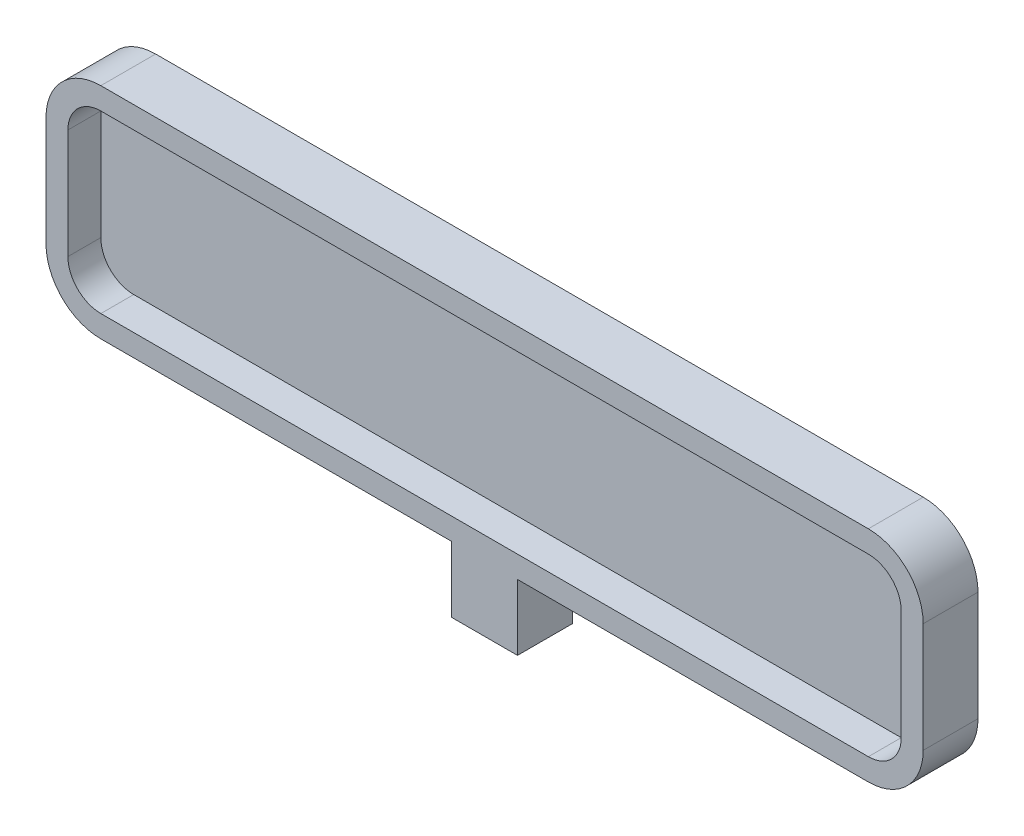
from build123d import *

# Parameters (mm, degrees)
SKETCH2_W           = 80
SKETCH2_H           = 20
BOSS_EXTRUDE1_DEPTH = 2.5
FILLET1_R           = 5
FILLET2_R           = 5
SHELL1_T            = -2
SKETCH3_W           = 6
SKETCH3_H           = 5
BOSS_EXTRUDE2_DEPTH = 6
SKETCH4_R           = 1.425
CUT_EXTRUDE1_DEPTH  = 4


with BuildPart() as part:
    # Sketch2 → Boss-Extrude1 (new, symmetric)
    with BuildSketch(Plane.XY):
        Rectangle(SKETCH2_W, SKETCH2_H)
    extrude(amount=BOSS_EXTRUDE1_DEPTH, both=True)

    # Fillet1
    fillet1_edges = [part.edges().sort_by_distance(p)[0] for p in [
        (40, -10, 0),
        (-40, -10, 0),
    ]]
    fillet(fillet1_edges, radius=FILLET1_R)

    # Fillet2
    fillet2_edges = [part.edges().sort_by_distance(p)[0] for p in [
        (-40, 10, 0),
        (40, 10, 0),
    ]]
    fillet(fillet2_edges, radius=FILLET2_R)

    # Shell1
    shell1_openings = [part.faces().sort_by_distance(p)[0] for p in [
        (0, 0, 2.5),
    ]]
    offset(amount=SHELL1_T, openings=shell1_openings, kind=Kind.INTERSECTION)

    # Sketch3 → Boss-Extrude2 (add)
    with BuildSketch(Plane.XZ.offset(10)):
        Rectangle(SKETCH3_W, SKETCH3_H)
    extrude(amount=BOSS_EXTRUDE2_DEPTH)

    # Sketch4 → Cut-Extrude1 (cut)
    with BuildSketch(Plane.XZ.offset(16)):
        with Locations(Location((0, 0, 0), (0, 0, 270))):
            Circle(SKETCH4_R)
    extrude(amount=-CUT_EXTRUDE1_DEPTH, mode=Mode.SUBTRACT)


solid = part.part
